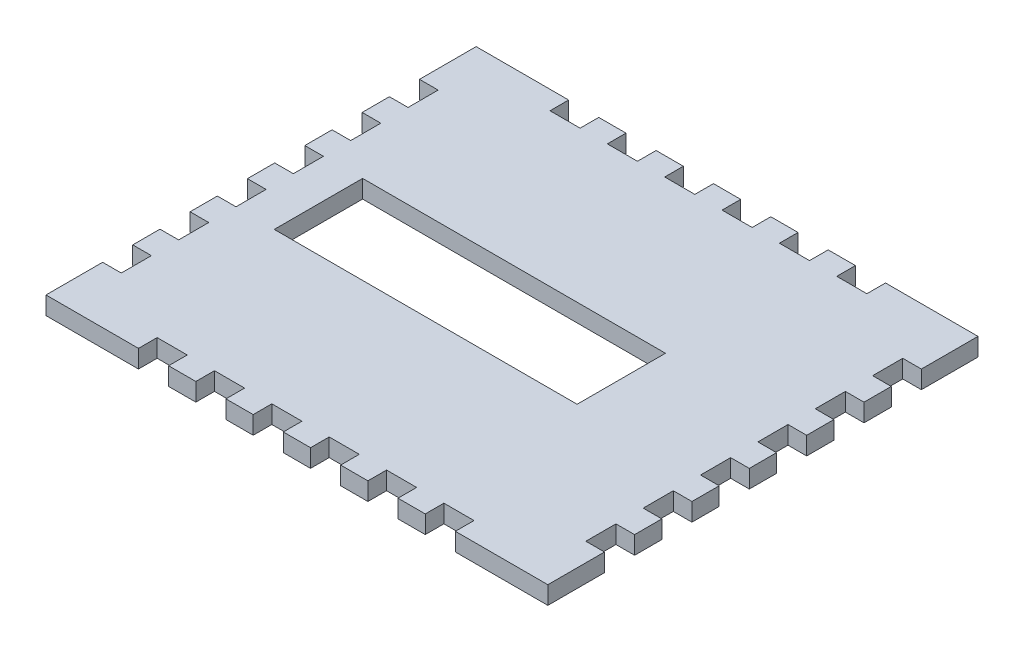
from build123d import *

# Parameters (mm, degrees)
SKETCH1_W           = 88.9
SKETCH1_H           = 76.2
SKETCH1_W_2         = 53.65
SKETCH1_H_2         = 15.65
BOSS_EXTRUDE1_DEPTH = 3.175
SKETCH2_W           = 5.334
SKETCH2_H           = 3.302
SKETCH2_W_2         = 3.302
SKETCH2_H_2         = 5.334
CUT_EXTRUDE1_DEPTH  = 59.630138368


with BuildPart() as part:
    # Sketch1 → Boss-Extrude1 (new body)
    with BuildSketch(Plane(origin=(0, 0, 0), x_dir=(1, 0, 0), z_dir=(0, 1, 0))):
        Rectangle(SKETCH1_W, SKETCH1_H)
        with Locations((-7.465, 0)):
            Rectangle(SKETCH1_W_2, SKETCH1_H_2, mode=Mode.SUBTRACT)
    extrude(amount=BOSS_EXTRUDE1_DEPTH)

    # Sketch2 → Cut-Extrude1 (cut, through all)
    with BuildSketch(Plane(origin=(0, 0, 0), x_dir=(1, 0, 0), z_dir=(0, 1, 0))):
        with Locations((-25.4, -36.449)):
            Rectangle(SKETCH2_W, SKETCH2_H)
        with Locations((-42.799, -15.24)):
            Rectangle(SKETCH2_W_2, SKETCH2_H_2)
        with Locations((-42.799, -25.4)):
            Rectangle(SKETCH2_W_2, SKETCH2_H_2)
        with Locations((-42.799, -5.08)):
            Rectangle(SKETCH2_W_2, SKETCH2_H_2)
        with Locations((-42.799, 5.08)):
            Rectangle(SKETCH2_W_2, SKETCH2_H_2)
        with Locations((-42.799, 15.24)):
            Rectangle(SKETCH2_W_2, SKETCH2_H_2)
        with Locations((-42.799, 25.4)):
            Rectangle(SKETCH2_W_2, SKETCH2_H_2)
        with Locations((42.799, 25.4)):
            Rectangle(SKETCH2_W_2, SKETCH2_H_2)
        with Locations((42.799, 15.24)):
            Rectangle(SKETCH2_W_2, SKETCH2_H_2)
        with Locations((42.799, 5.08)):
            Rectangle(SKETCH2_W_2, SKETCH2_H_2)
        with Locations((42.799, -5.08)):
            Rectangle(SKETCH2_W_2, SKETCH2_H_2)
        with Locations((42.799, -15.24)):
            Rectangle(SKETCH2_W_2, SKETCH2_H_2)
        with Locations((42.799, -25.4)):
            Rectangle(SKETCH2_W_2, SKETCH2_H_2)
        with Locations((-15.24, -36.449)):
            Rectangle(SKETCH2_W, SKETCH2_H)
        with Locations((-5.08, -36.449)):
            Rectangle(SKETCH2_W, SKETCH2_H)
        with Locations((5.08, -36.449)):
            Rectangle(SKETCH2_W, SKETCH2_H)
        with Locations((15.24, -36.449)):
            Rectangle(SKETCH2_W, SKETCH2_H)
        with Locations((25.4, -36.449)):
            Rectangle(SKETCH2_W, SKETCH2_H)
        with Locations((25.4, 36.449)):
            Rectangle(SKETCH2_W, SKETCH2_H)
        with Locations((15.24, 36.449)):
            Rectangle(SKETCH2_W, SKETCH2_H)
        with Locations((5.08, 36.449)):
            Rectangle(SKETCH2_W, SKETCH2_H)
        with Locations((-5.08, 36.449)):
            Rectangle(SKETCH2_W, SKETCH2_H)
        with Locations((-15.24, 36.449)):
            Rectangle(SKETCH2_W, SKETCH2_H)
        with Locations((-25.4, 36.449)):
            Rectangle(SKETCH2_W, SKETCH2_H)
    extrude(amount=CUT_EXTRUDE1_DEPTH, mode=Mode.SUBTRACT)


solid = part.part
